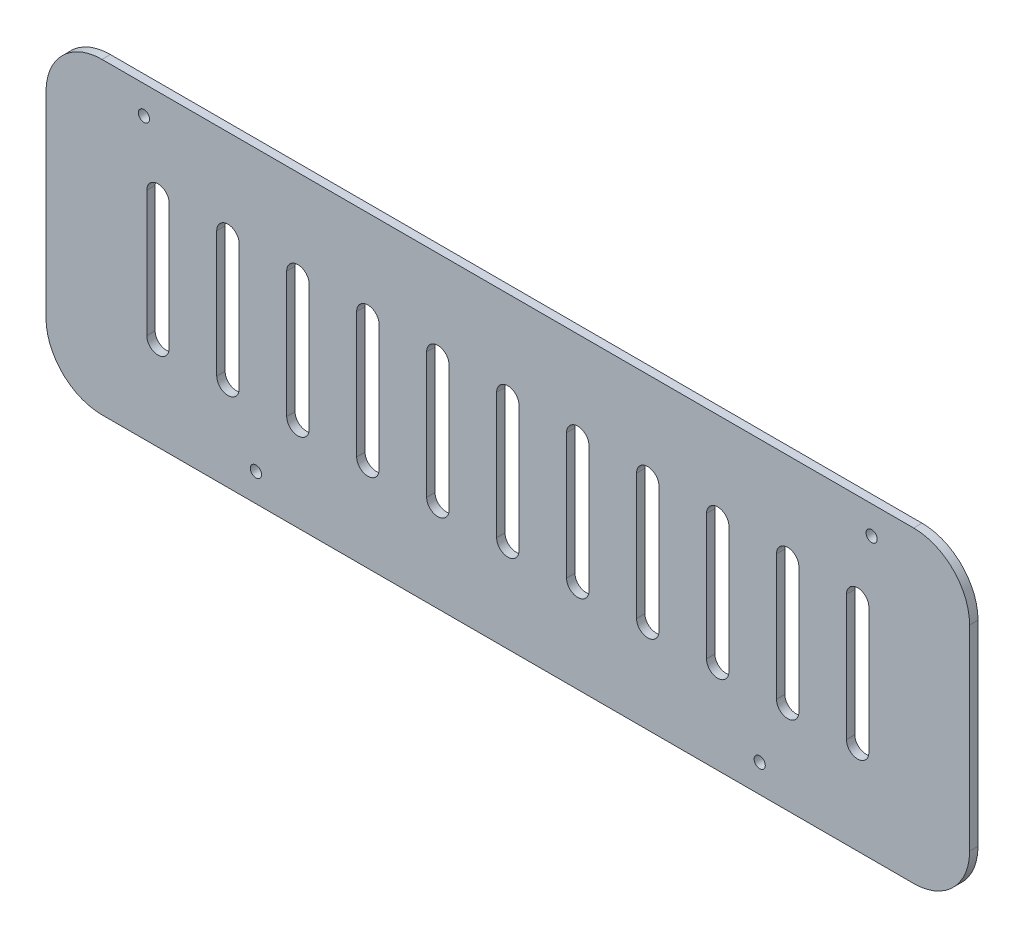
from build123d import *

# Parameters (mm, degrees)
SKETCH_2_W          = 330
SKETCH_2_H          = 110
SKETCH_2_R          = 2
EXTRUDE_1_DEPTH     = 3
CUT_EXTRUDE_1_DEPTH = 198.929546993
FILLET_1_R          = 20


with BuildPart() as part:
    # 草图2 → 凸台-拉伸1 (new body)
    with BuildSketch(Plane.XY):
        with Locations((20.115321252, 14.995881384)):
            Rectangle(SKETCH_2_W, SKETCH_2_H)
        with Locations((-109.884678748, 59.995881384)):
            Circle(SKETCH_2_R, mode=Mode.SUBTRACT)
        with Locations(Location((150.115321252, 59.995881384, 0), (0, 0, 180))):
            Circle(SKETCH_2_R, mode=Mode.SUBTRACT)
        with Locations((-69.884678748, -30.004118616)):
            Circle(SKETCH_2_R, mode=Mode.SUBTRACT)
        with Locations(Location((110.115321252, -30.004118616, 0), (0, 0, 180))):
            Circle(SKETCH_2_R, mode=Mode.SUBTRACT)
    extrude(amount=EXTRUDE_1_DEPTH)

    # 草图3 → 切除-拉伸1 (cut, through all)
    with BuildSketch(Plane.XY.offset(3)):
        with BuildLine():
            Line((16.115321252, -7.504118616), (16.115321252, 37.495881384))
            ThreePointArc((16.115321252, 37.495881384), (20.115321252, 41.495881384), (24.115321252, 37.495881384))
            Line((24.115321252, 37.495881384), (24.115321252, -7.504118616))
            ThreePointArc((24.115321252, -7.504118616), (20.115321252, -11.504118616), (16.115321252, -7.504118616))
        make_face()
        with BuildLine():
            Line((41.115321252, -7.504118616), (41.115321252, 37.495881384))
            ThreePointArc((41.115321252, 37.495881384), (45.115321252, 41.495881384), (49.115321252, 37.495881384))
            Line((49.115321252, 37.495881384), (49.115321252, -7.504118616))
            ThreePointArc((49.115321252, -7.504118616), (45.115321252, -11.504118616), (41.115321252, -7.504118616))
        make_face()
        with BuildLine():
            Line((66.115321252, -7.504118616), (66.115321252, 37.495881384))
            ThreePointArc((66.115321252, 37.495881384), (70.115321252, 41.495881384), (74.115321252, 37.495881384))
            Line((74.115321252, 37.495881384), (74.115321252, -7.504118616))
            ThreePointArc((74.115321252, -7.504118616), (70.115321252, -11.504118616), (66.115321252, -7.504118616))
        make_face()
        with BuildLine():
            Line((91.115321252, -7.504118616), (91.115321252, 37.495881384))
            ThreePointArc((91.115321252, 37.495881384), (95.115321252, 41.495881384), (99.115321252, 37.495881384))
            Line((99.115321252, 37.495881384), (99.115321252, -7.504118616))
            ThreePointArc((99.115321252, -7.504118616), (95.115321252, -11.504118616), (91.115321252, -7.504118616))
        make_face()
        with BuildLine():
            Line((116.115321252, -7.504118616), (116.115321252, 37.495881384))
            ThreePointArc((116.115321252, 37.495881384), (120.115321252, 41.495881384), (124.115321252, 37.495881384))
            Line((124.115321252, 37.495881384), (124.115321252, -7.504118616))
            ThreePointArc((124.115321252, -7.504118616), (120.115321252, -11.504118616), (116.115321252, -7.504118616))
        make_face()
        with BuildLine():
            Line((141.115321252, -7.504118616), (141.115321252, 37.495881384))
            ThreePointArc((141.115321252, 37.495881384), (145.115321252, 41.495881384), (149.115321252, 37.495881384))
            Line((149.115321252, 37.495881384), (149.115321252, -7.504118616))
            ThreePointArc((149.115321252, -7.504118616), (145.115321252, -11.504118616), (141.115321252, -7.504118616))
        make_face()
        with BuildLine():
            Line((-0.884678748, -7.504118616), (-0.884678748, 37.495881384))
            ThreePointArc((-0.884678748, 37.495881384), (-4.884678748, 41.495881384), (-8.884678748, 37.495881384))
            Line((-8.884678748, 37.495881384), (-8.884678748, -7.504118616))
            ThreePointArc((-8.884678748, -7.504118616), (-4.884678748, -11.504118616), (-0.884678748, -7.504118616))
        make_face()
        with BuildLine():
            Line((-25.884678748, -7.504118616), (-25.884678748, 37.495881384))
            ThreePointArc((-25.884678748, 37.495881384), (-29.884678748, 41.495881384), (-33.884678748, 37.495881384))
            Line((-33.884678748, 37.495881384), (-33.884678748, -7.504118616))
            ThreePointArc((-33.884678748, -7.504118616), (-29.884678748, -11.504118616), (-25.884678748, -7.504118616))
        make_face()
        with BuildLine():
            Line((-50.884678748, -7.504118616), (-50.884678748, 37.495881384))
            ThreePointArc((-50.884678748, 37.495881384), (-54.884678748, 41.495881384), (-58.884678748, 37.495881384))
            Line((-58.884678748, 37.495881384), (-58.884678748, -7.504118616))
            ThreePointArc((-58.884678748, -7.504118616), (-54.884678748, -11.504118616), (-50.884678748, -7.504118616))
        make_face()
        with BuildLine():
            Line((-75.884678748, -7.504118616), (-75.884678748, 37.495881384))
            ThreePointArc((-75.884678748, 37.495881384), (-79.884678748, 41.495881384), (-83.884678748, 37.495881384))
            Line((-83.884678748, 37.495881384), (-83.884678748, -7.504118616))
            ThreePointArc((-83.884678748, -7.504118616), (-79.884678748, -11.504118616), (-75.884678748, -7.504118616))
        make_face()
        with BuildLine():
            Line((-100.884678748, -7.504118616), (-100.884678748, 37.495881384))
            ThreePointArc((-100.884678748, 37.495881384), (-104.884678748, 41.495881384), (-108.884678748, 37.495881384))
            Line((-108.884678748, 37.495881384), (-108.884678748, -7.504118616))
            ThreePointArc((-108.884678748, -7.504118616), (-104.884678748, -11.504118616), (-100.884678748, -7.504118616))
        make_face()
    extrude(amount=-CUT_EXTRUDE_1_DEPTH, mode=Mode.SUBTRACT)

    # 圆角1
    fillet_1_edges = [part.edges().sort_by_distance(p)[0] for p in [
        (-144.884678748, 69.995881384, 1.5),
        (185.115321252, 69.995881384, 1.5),
        (185.115321252, -40.004118616, 1.5),
        (-144.884678748, -40.004118616, 1.5),
    ]]
    fillet(fillet_1_edges, radius=FILLET_1_R)


solid = part.part
